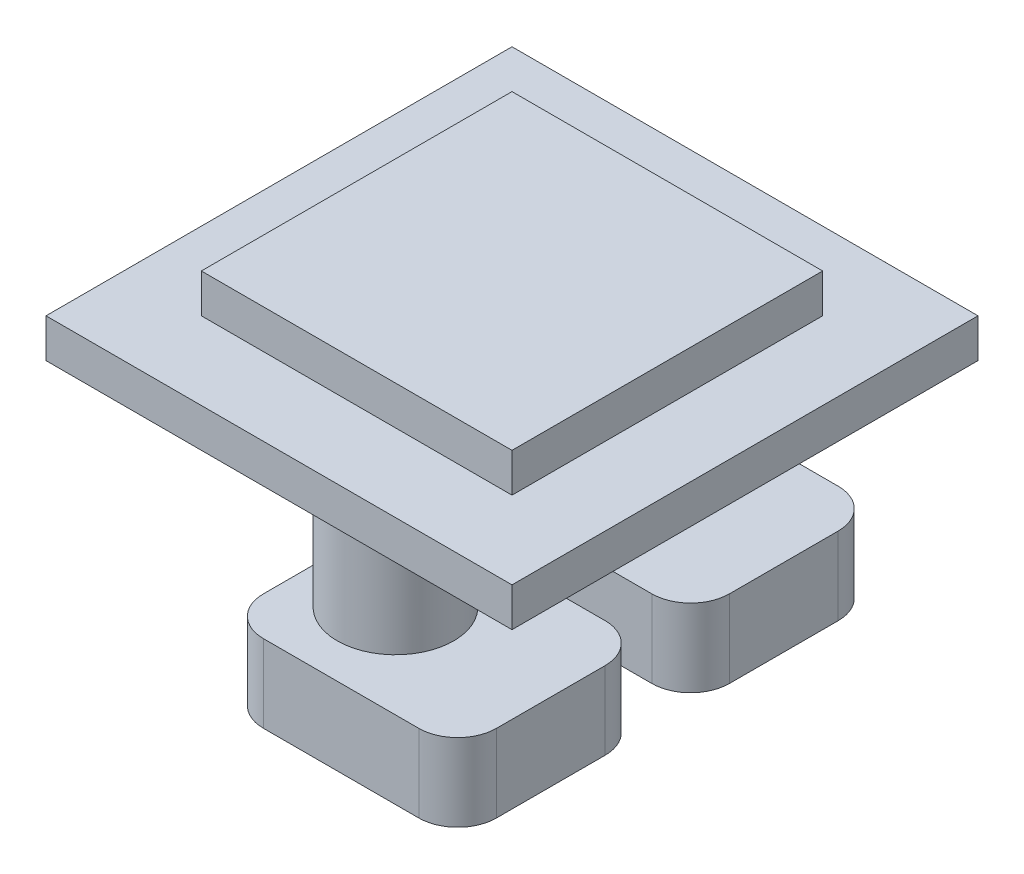
from build123d import *

# Parameters (mm, degrees)
SKETCH1_W           = 40
SKETCH1_H           = 40
BOSS_EXTRUDE1_DEPTH = 5
SKETCH2_W           = 60
SKETCH2_H           = 60
BOSS_EXTRUDE2_DEPTH = 5
SKETCH3_R           = 7.5
BOSS_EXTRUDE3_DEPTH = 30
SKETCH4_W           = 30
SKETCH4_H           = 24
BOSS_EXTRUDE5_DEPTH = 10
FILLET1_R           = 5


with BuildPart() as part:
    # Sketch1 → Boss-Extrude1 (new body)
    with BuildSketch(Plane(origin=(0, 0, 0), x_dir=(1, 0, 0), z_dir=(0, 1, 0))):
        with Locations((20, 20)):
            Rectangle(SKETCH1_W, SKETCH1_H)
    extrude(amount=BOSS_EXTRUDE1_DEPTH)

    # Sketch2 → Boss-Extrude2 (add)
    with BuildSketch(Plane(origin=(0, 0, 0), x_dir=(-1, 0, 0), z_dir=(0, -1, 0))):
        with Locations((-20, 20)):
            Rectangle(SKETCH2_W, SKETCH2_H)
    extrude(amount=BOSS_EXTRUDE2_DEPTH)

    # Sketch3 → Boss-Extrude3 (add)
    with BuildSketch(Plane(origin=(0, -5, 0), x_dir=(-1, 0, 0), z_dir=(0, -1, 0))):
        with Locations(Location((-20, 5, 0), (0, 0, 90))):
            Circle(SKETCH3_R)
        with Locations(Location((-20, 35, 0), (0, 0, 90))):
            Circle(SKETCH3_R)
    extrude(amount=BOSS_EXTRUDE3_DEPTH)

    # Sketch4 → Boss-Extrude5 (add)
    with BuildSketch(Plane(origin=(0, -35, 0), x_dir=(-1, 0, 0), z_dir=(0, -1, 0))):
        with Locations((-25, 5)):
            Rectangle(SKETCH4_W, SKETCH4_H)
        with Locations((-25, 35)):
            Rectangle(SKETCH4_W, SKETCH4_H)
    extrude(amount=-BOSS_EXTRUDE5_DEPTH)

    # Fillet1
    fillet1_edges = [part.edges().sort_by_distance(p)[0] for p in [
        (40, -30, 7),
        (40, -30, -17),
        (10, -30, -17),
        (10, -30, 7),
        (40, -30, -23),
        (40, -30, -47),
        (10, -30, -47),
        (10, -30, -23),
    ]]
    fillet(fillet1_edges, radius=FILLET1_R)


solid = part.part
